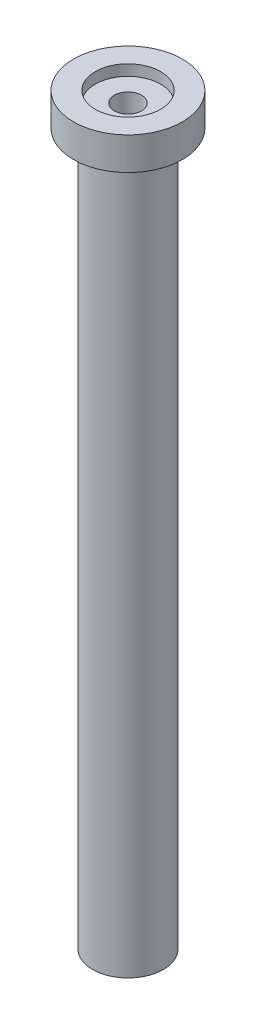
from build123d import *

# Parameters (mm, degrees)
SKETCH1_R           = 3.25
BOSS_EXTRUDE1_DEPTH = 65.3
SKETCH2_R           = 5
BOSS_EXTRUDE2_DEPTH = 3
SKETCH3_R           = 1.425
CUT_EXTRUDE1_DEPTH  = 9
SHELL1_T            = -2


with BuildPart() as part:
    # Sketch1 → Boss-Extrude1 (new body)
    with BuildSketch(Plane(origin=(0, 0, 0), x_dir=(1, 0, 0), z_dir=(0, 1, 0))):
        with Locations(Location((0, 0, 0), (0, 0, 270))):
            Circle(SKETCH1_R)
    extrude(amount=BOSS_EXTRUDE1_DEPTH)

    # Sketch2 → Boss-Extrude2 (add)
    with BuildSketch(Plane(origin=(0, 65.3, 0), x_dir=(1, 0, 0), z_dir=(0, 1, 0))):
        with Locations(Location((0, 0, 0), (0, 0, 270))):
            Circle(SKETCH2_R)
    extrude(amount=BOSS_EXTRUDE2_DEPTH)

    # Sketch3 → Cut-Extrude1 (cut)
    with BuildSketch(Plane.XZ):
        with Locations(Location((0, 0, 0), (0, 0, 270))):
            Circle(SKETCH3_R)
    extrude(amount=-CUT_EXTRUDE1_DEPTH, mode=Mode.SUBTRACT)

    # Shell1
    shell1_openings = [part.faces().sort_by_distance(p)[0] for p in [
        (0, 68.3, 0),
    ]]
    offset(amount=SHELL1_T, openings=shell1_openings, kind=Kind.INTERSECTION)


solid = part.part
